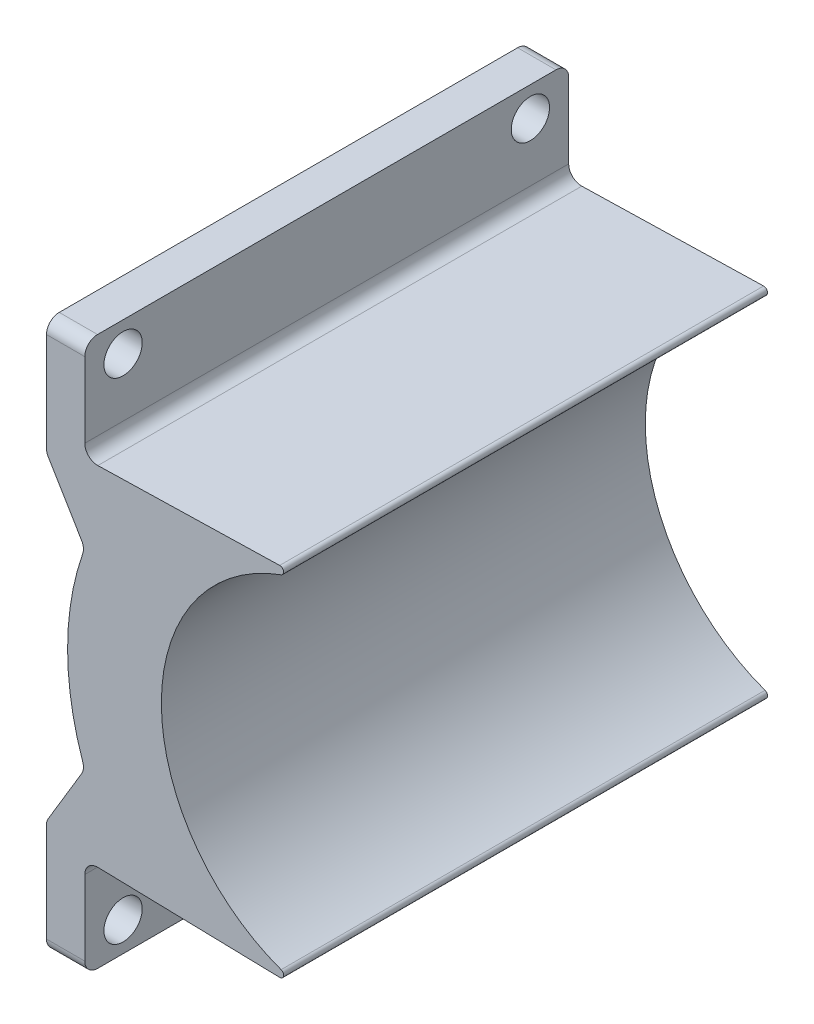
from build123d import *

# Parameters (mm, degrees)
EXTRUDE_1_DEPTH     = 37.9
CUT_EXTRUDE_1_REACH = 62.967
SKETCH_4_R          = 1.5
FILLET_1_R          = 0.3
FILLET_2_R          = 1


with BuildPart() as part:
    # 草图3 → 凸台-拉伸1 (new body)
    with BuildSketch(Plane.XY):
        with BuildLine():
            Line((-1.5, 0), (-4.5, 0))
            Line((-4.5, 0), (-4.5, -9))
            Line((-4.5, -9), (-1.5, -14))
            ThreePointArc((-1.5, -14), (-2.844270073, -21.5), (-1.5, -29))
            Line((-1.5, -29), (-4.5, -34))
            Line((-4.5, -34), (-4.5, -43))
            Line((-4.5, -43), (-1.5, -43))
            Line((-1.5, -43), (-1.5, -35.1))
            Line((-1.5, -35.1), (16.275513468, -35.53351048))
            ThreePointArc((16.275513468, -35.53351048), (4.5, -21.5), (16.275513468, -7.46648952))
            Line((16.275513468, -7.46648952), (-1.5, -7.9))
            Line((-1.5, -7.9), (-1.5, 0))
        make_face()
    extrude(amount=EXTRUDE_1_DEPTH)

    # 草图4 → 切除-拉伸1 (cut, up to next)
    with BuildSketch(Plane.ZY.offset(4.5), mode=Mode.PRIVATE) as cut_extrude_1_sk1:
        with Locations(Location((3, -40.7, 0), (0, 0, 270))):
            Circle(SKETCH_4_R)
    cut_extrude_1_tool1 = extrude(cut_extrude_1_sk1.sketch, amount=-CUT_EXTRUDE_1_REACH, mode=Mode.PRIVATE) & part.part
    # 草图4 → 切除-拉伸1 (cut, up to next)
    with BuildSketch(Plane.ZY.offset(4.5), mode=Mode.PRIVATE) as cut_extrude_1_sk2:
        with Locations(Location((34.9, -40.7, 0), (0, 0, 270))):
            Circle(SKETCH_4_R)
    cut_extrude_1_tool2 = extrude(cut_extrude_1_sk2.sketch, amount=-CUT_EXTRUDE_1_REACH, mode=Mode.PRIVATE) & part.part
    # 草图4 → 切除-拉伸1 (cut, up to next)
    with BuildSketch(Plane.ZY.offset(4.5), mode=Mode.PRIVATE) as cut_extrude_1_sk3:
        with Locations(Location((3, -2.3, 0), (0, 0, 270))):
            Circle(SKETCH_4_R)
    cut_extrude_1_tool3 = extrude(cut_extrude_1_sk3.sketch, amount=-CUT_EXTRUDE_1_REACH, mode=Mode.PRIVATE) & part.part
    # 草图4 → 切除-拉伸1 (cut, up to next)
    with BuildSketch(Plane.ZY.offset(4.5), mode=Mode.PRIVATE) as cut_extrude_1_sk4:
        with Locations(Location((34.9, -2.3, 0), (0, 0, 270))):
            Circle(SKETCH_4_R)
    cut_extrude_1_tool4 = extrude(cut_extrude_1_sk4.sketch, amount=-CUT_EXTRUDE_1_REACH, mode=Mode.PRIVATE) & part.part
    add(cut_extrude_1_tool1.solids().sort_by_distance((-4.5, -40.7, 3))[0], mode=Mode.SUBTRACT)
    add(cut_extrude_1_tool2.solids().sort_by_distance((-4.5, -40.7, 34.9))[0], mode=Mode.SUBTRACT)
    add(cut_extrude_1_tool3.solids().sort_by_distance((-4.5, -2.3, 3))[0], mode=Mode.SUBTRACT)
    add(cut_extrude_1_tool4.solids().sort_by_distance((-4.5, -2.3, 34.9))[0], mode=Mode.SUBTRACT)

    # 圆角1
    fillet_1_edges = [part.edges().sort_by_distance(p)[0] for p in [
        (16.275513468, -35.53351048, 18.95),
        (16.275513468, -7.46648952, 18.95),
    ]]
    fillet(fillet_1_edges, radius=FILLET_1_R)

    # 圆角2
    fillet_2_edges = [part.edges().sort_by_distance(p)[0] for p in [
        (-3, -43, 0),
        (-3, 0, 0),
        (-3, 0, 37.9),
        (-1.5, -35.1, 18.95),
        (-4.5, -34, 18.95),
        (-1.5, -29, 18.95),
        (-1.5, -14, 18.95),
        (-4.5, -9, 18.95),
        (-1.5, -7.9, 18.95),
        (-3, -43, 37.9),
    ]]
    fillet(fillet_2_edges, radius=FILLET_2_R)


solid = part.part
